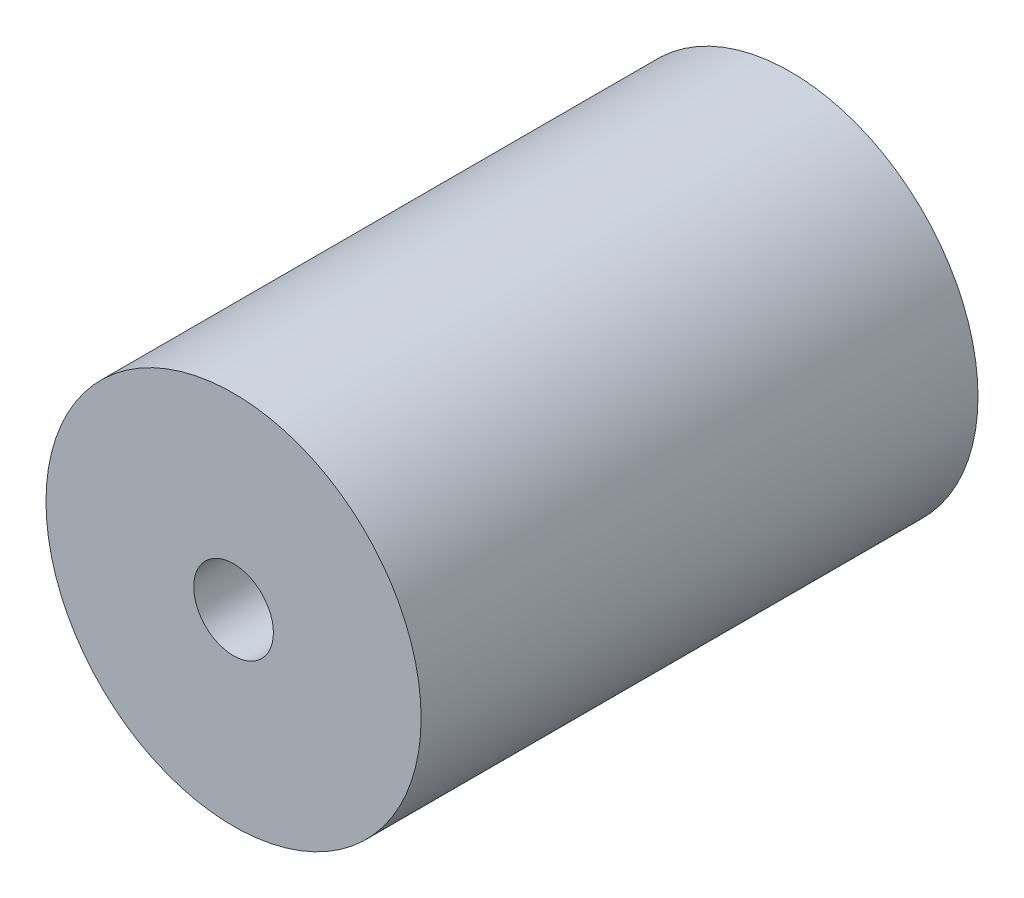
from build123d import *

# Parameters (mm, degrees)
SKETCH1_R           = 10
SKETCH1_R_2         = 2.125000052
BOSS_EXTRUDE1_DEPTH = 29.693


with BuildPart() as part:
    # Sketch1 → Boss-Extrude1 (new body)
    with BuildSketch(Plane.XY):
        Circle(SKETCH1_R)
        Circle(SKETCH1_R_2, mode=Mode.SUBTRACT)
    extrude(amount=BOSS_EXTRUDE1_DEPTH)


solid = part.part
